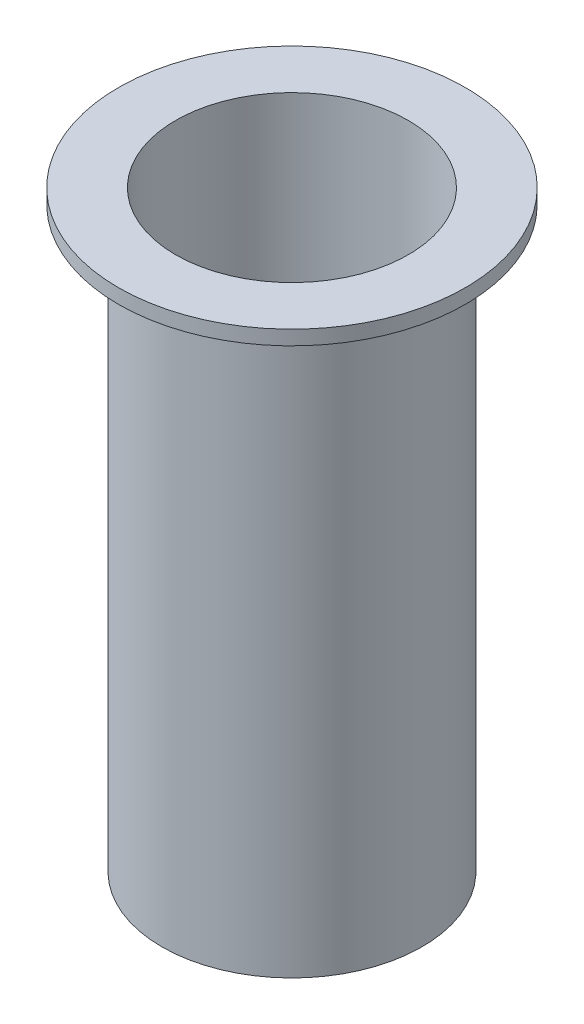
from build123d import *

# Parameters (mm, degrees)
SKETCH1_R               = 57.15
SKETCH1_R_2             = 51.1302
SCHEDULED_CHAMBER_DEPTH = 260.35
SKETCH2_R               = 76.2
SKETCH2_R_2             = 54.102
FLANGE_DEPTH            = 6.35


with BuildPart() as part:
    # Sketch1 → Scheduled Chamber (new body)
    with BuildSketch(Plane(origin=(0, 0, 0), x_dir=(1, 0, 0), z_dir=(0, 1, 0))):
        Circle(SKETCH1_R)
        Circle(SKETCH1_R_2, mode=Mode.SUBTRACT)
    extrude(amount=-SCHEDULED_CHAMBER_DEPTH)

    # Sketch2 → Flange (add)
    with BuildSketch(Plane(origin=(0, 0, 0), x_dir=(1, 0, 0), z_dir=(0, 1, 0))):
        Circle(SKETCH2_R)
        Circle(SKETCH2_R_2, mode=Mode.SUBTRACT)
    extrude(amount=-FLANGE_DEPTH)


solid = part.part
